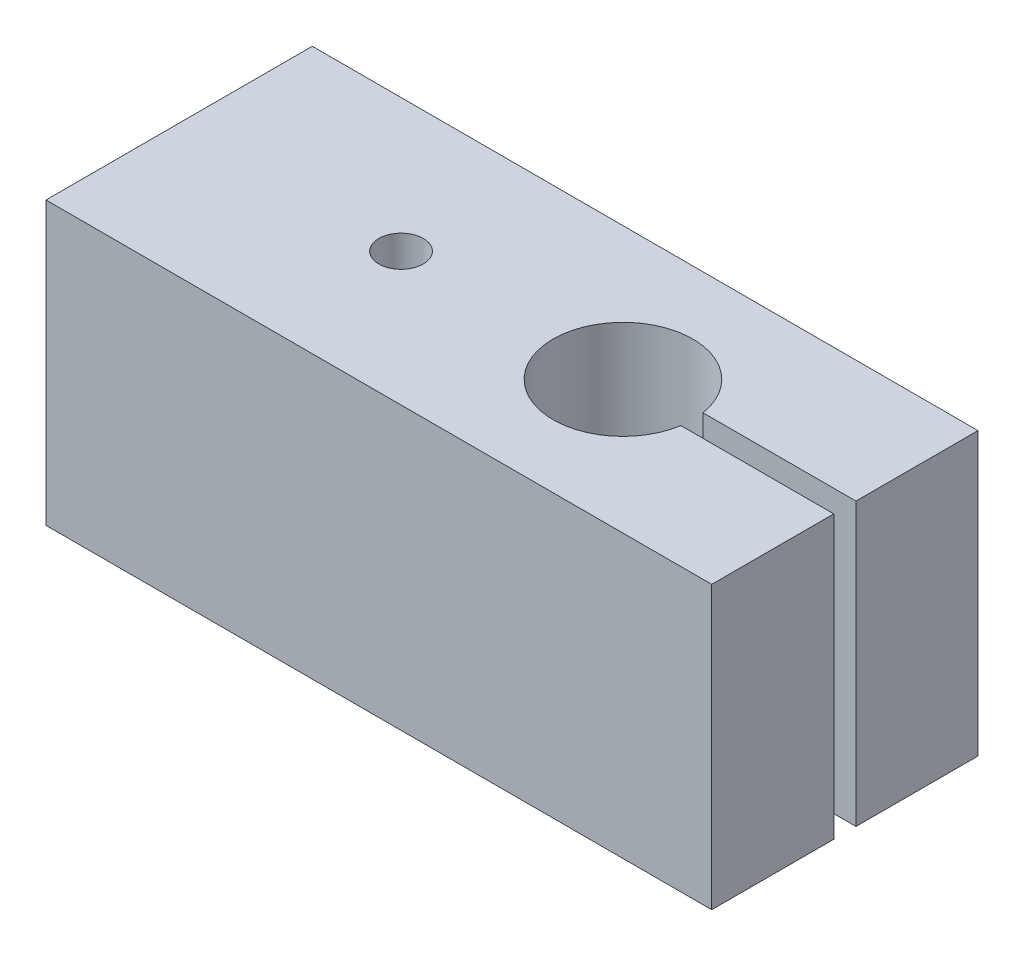
from build123d import *

# Parameters (mm, degrees)
SKETCH1_W           = 30
SKETCH1_H           = 12
SKETCH1_R           = 3.15
SKETCH1_R_2         = 1
BOSS_EXTRUDE1_DEPTH = 12.7
SKETCH2_R           = 4
CUT_EXTRUDE1_DEPTH  = 10
SKETCH3_W           = 6.889935692
SKETCH3_H           = 1
CUT_EXTRUDE2_DEPTH  = 25.439517314


with BuildPart() as part:
    # Sketch1 → Boss-Extrude1 (new body)
    with BuildSketch(Plane(origin=(0, 0, 0), x_dir=(1, 0, 0), z_dir=(0, 1, 0))):
        with Locations((-5, 0)):
            Rectangle(SKETCH1_W, SKETCH1_H)
        with Locations(Location((0, 0, 0), (0, 0, 270))):
            Circle(SKETCH1_R, mode=Mode.SUBTRACT)
        with Locations(Location((-10, 0, 0), (0, 0, 270))):
            Circle(SKETCH1_R_2, mode=Mode.SUBTRACT)
    extrude(amount=BOSS_EXTRUDE1_DEPTH)

    # Sketch2 → Cut-Extrude1 (cut)
    with BuildSketch(Plane.ZY.offset(20)):
        with Locations((0, 6.35)):
            Circle(SKETCH2_R)
    extrude(amount=-CUT_EXTRUDE1_DEPTH, mode=Mode.SUBTRACT)

    # Sketch3 → Cut-Extrude2 (cut, through all)
    with BuildSketch(Plane(origin=(0, 12.7, 0), x_dir=(1, 0, 0), z_dir=(0, 1, 0))):
        with Locations((6.555032154, 0)):
            Rectangle(SKETCH3_W, SKETCH3_H)
    extrude(amount=-CUT_EXTRUDE2_DEPTH, mode=Mode.SUBTRACT)


solid = part.part
